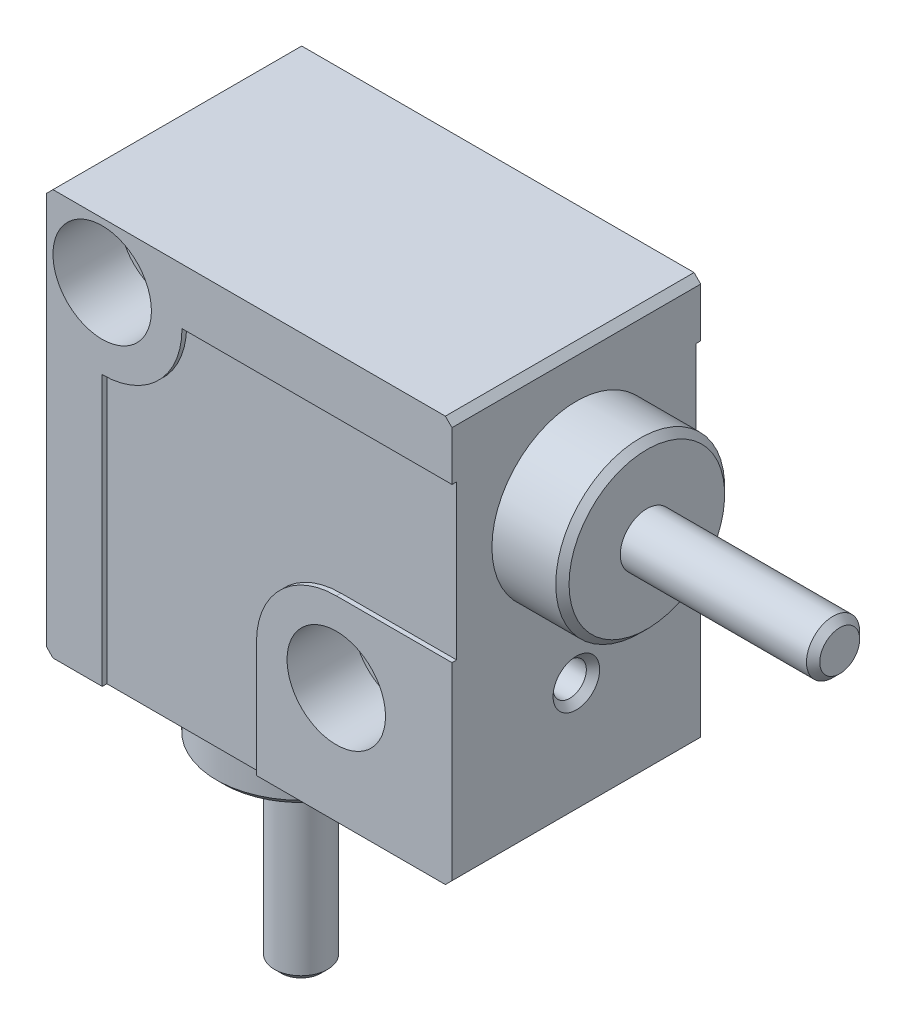
from build123d import *

# Parameters (mm, degrees)
ESQUISSE1_W             = 30.5
ESQUISSE1_H             = 30.5
BOSS_EXTRU_1_DEPTH      = 9.35
TROU_TARAUD_M31_D       = 2.5
TROU_TARAUD_M31_DEPTH   = 8.5
TROU_TARAUD_M31_TIP     = 0.751075774
TROU_TARAUD_M32_D       = 2.5
TROU_TARAUD_M32_DEPTH   = 8.5
TROU_TARAUD_M32_TIP     = 0.751075774
PER_AGE1_AT_2_COUNT     = 2
PER_AGE1_AT_2_PITCH     = 24.890158698
ENL_V_MAT_EXTRU_3_DEPTH = 0.35
CHANFREIN1_SIZE         = 0.5


with BuildPart() as part:
    # Esquisse1 → Boss.-Extru.1 (new, symmetric)
    with BuildSketch(Plane.XY):
        Rectangle(ESQUISSE1_W, ESQUISSE1_H)
    extrude(amount=BOSS_EXTRU_1_DEPTH, both=True)

    # Esquisse2 → Révolution1 (revolve)
    with BuildSketch(Plane.XY, mode=Mode.PRIVATE) as r_volution1_sk:
        Polygon((35.05, 5.45), (35.05, 7.45), (20.55, 7.45), (20.55, 11.8), (15.25, 11.8), (15.25, 5.45), align=None)
    revolve(r_volution1_sk.sketch.rotate(Axis((15.25, 5.45, 0), (1, 0, 0)), 90), axis=Axis((15.25, 5.45, 0), (1, 0, 0)))

    # Esquisse3 → Révolution2 (revolve)
    with BuildSketch(Plane.XY):
        Polygon((-5.45, -35.05), (-7.45, -35.05), (-7.45, -20.55), (-11.8, -20.55), (-11.8, -15.25), (-5.45, -15.25), align=None)
    revolve(axis=Axis((-5.45, -15.25, 0), (0, -1, 0)))

    # Trou taraudé M31
    with Locations(Plane(origin=(15.25, 0, 0), x_dir=(0, 0, -1), z_dir=(1, 0, 0))):
        with Locations((0, -6.55)):
            Hole(TROU_TARAUD_M31_D / 2, depth=TROU_TARAUD_M31_DEPTH)
            with Locations((0, 0, -(TROU_TARAUD_M31_DEPTH + TROU_TARAUD_M31_TIP / 2))):  # 118° drill point
                Cone(0, TROU_TARAUD_M31_D / 2, TROU_TARAUD_M31_TIP, mode=Mode.SUBTRACT)

    # Trou taraudé M32
    with Locations(Plane(origin=(0, -15.25, 0), x_dir=(-1, 0, 0), z_dir=(0, -1, 0))):
        with Locations((-6.55, 0)):
            Hole(TROU_TARAUD_M32_D / 2, depth=TROU_TARAUD_M32_DEPTH)
            with Locations((0, 0, -(TROU_TARAUD_M32_DEPTH + TROU_TARAUD_M32_TIP / 2))):  # 118° drill point
                Cone(0, TROU_TARAUD_M32_D / 2, TROU_TARAUD_M32_TIP, mode=Mode.SUBTRACT)

    # Esquisse8 → Perçage1 (revolve, cut)
    with BuildSketch(Plane(origin=(-11.05, 11.05, -9.35), x_dir=(0, 1, 0), z_dir=(1, 0, 0))):
        Polygon((0, 0), (0, 19.811592145), (1.85, 18.7), (1.85, 5), (3.7, 5), (3.7, 0), align=None)
    per_age1 = revolve(axis=Axis((-11.05, 11.05, -20.660875039), (0, 0, 1)), mode=Mode.SUBTRACT)

    # Perçage1 at 2: Perçage1 ×2
    with Locations(*[Vector(0.7071067811865476, -0.7071067811865476, 0) * (i * PER_AGE1_AT_2_PITCH) for i in range(1, PER_AGE1_AT_2_COUNT)]):
        add(per_age1, mode=Mode.SUBTRACT)

    # Esquisse10 → Enlèv. mat.-Extru.3 (cut)
    with BuildSketch(Plane.XY.offset(-9.35)):
        with BuildLine():
            Line((15.25, 11.05), (-5.05, 11.05))
            ThreePointArc((-5.05, 11.05), (-6.807359313, 6.807359313), (-11.05, 5.05))
            Line((-11.05, 5.05), (-11.05, -15.25))
            Line((-11.05, -15.25), (0.55, -15.25))
            Line((0.55, -15.25), (0.55, -6.55))
            ThreePointArc((0.55, -6.55), (2.307359313, -2.307359313), (6.55, -0.55))
            Line((6.55, -0.55), (15.25, -0.55))
            Line((15.25, -0.55), (15.25, 11.05))
        make_face()
    enl_v_mat_extru_3 = extrude(amount=ENL_V_MAT_EXTRU_3_DEPTH, mode=Mode.SUBTRACT)

    # Symétrie1: Perçage1, Enlèv. mat.-Extru.3 across plane
    add(per_age1.mirror(Plane.XY), mode=Mode.SUBTRACT)
    add(enl_v_mat_extru_3.mirror(Plane.XY), mode=Mode.SUBTRACT)

    # Symétrie1 copy 1 sketch → Symétrie1 copy 1 (revolve, cut)
    with BuildSketch(Plane(origin=(6.55, -6.55, 9.35), x_dir=(0, 1, 0), z_dir=(1, 0, 0))):
        Polygon((0, 0), (0, -19.811592145), (1.85, -18.7), (1.85, -5), (3.7, -5), (3.7, 0), align=None)
    revolve(axis=Axis((6.55, -6.55, 20.660875039), (0, 0, 1)), mode=Mode.SUBTRACT)

    # Chanfrein1
    chanfrein1_edges = [part.edges().sort_by_distance(p)[0] for p in [
        (35.05, 5.45, -2),
        (20.55, 5.45, -6.35),
        (-3.45, -35.05, 0),
        (0.9, -20.55, 0),
        (15.25, -6.55, -1.25),
        (5.3, -15.25, 0),
        (15.25, -15.25, 0),
        (-15.25, -15.25, 0),
        (-15.25, 15.25, 0),
        (15.25, 15.25, 0),
    ]]
    chamfer(chanfrein1_edges, length=CHANFREIN1_SIZE)


solid = part.part
